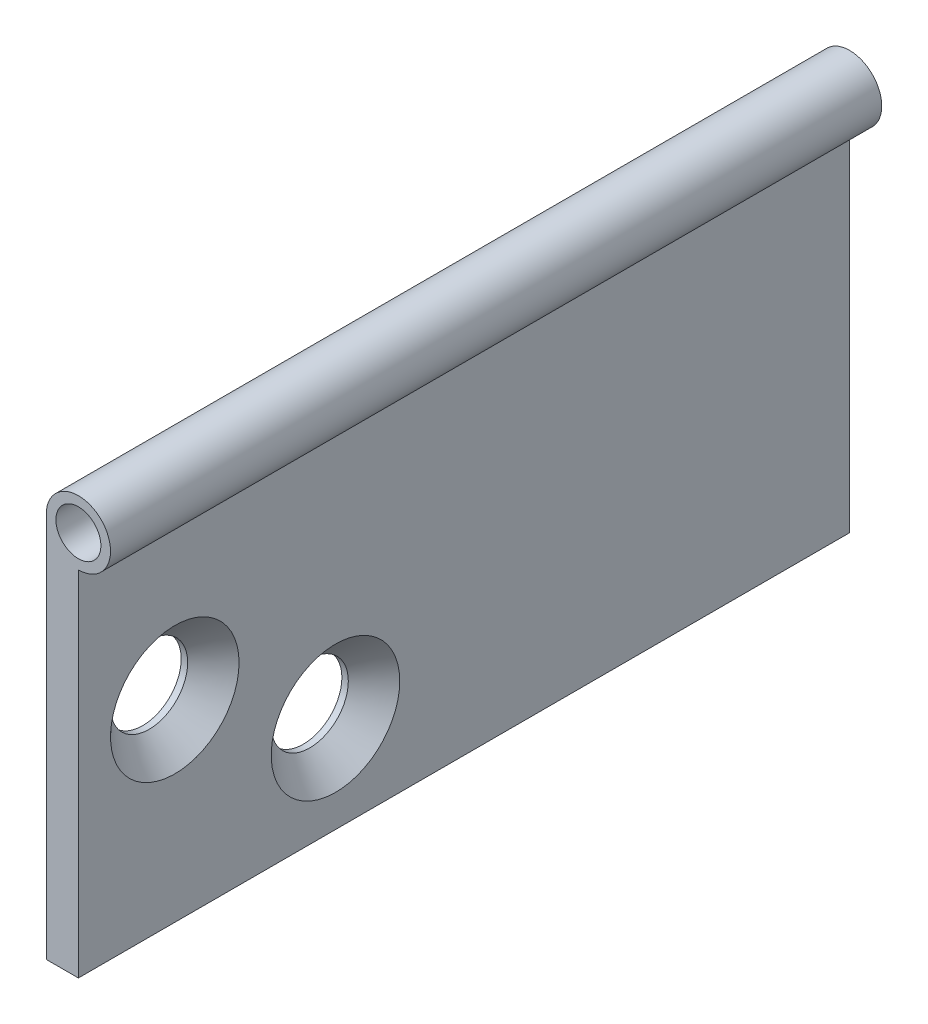
from build123d import *

# Parameters (mm, degrees)
SKETCH_1_W                  = 5
SKETCH_1_H                  = 60
EXTRUDE_2_DEPTH             = 60
SKETCH_2_R                  = 5
SKETCH_3_R                  = 3.5
CUT_EXTRUDE_1_DEPTH         = 137.839321834
HOLE_WIZARD_M101_AT_2_COUNT = 2
HOLE_WIZARD_M101_AT_2_PITCH = 29.154759474


with BuildPart() as part:
    # Эскиз1 → Вытянуть-Тонкостенный2 (new, symmetric)
    with BuildSketch(Plane.XY):
        with Locations((2.5, 30)):
            Rectangle(SKETCH_1_W, SKETCH_1_H)
    extrude(amount=EXTRUDE_2_DEPTH, both=True)

    # По траектории1: sweep along a curve in space
    with BuildLine() as sweep_1_path:
        Line((0, 60, 60), (0, 60, -60))
    # Эскиз2 → По траектории1 (sweep)
    with BuildSketch(Plane.XY.offset(60)):
        with Locations((5, 60)):
            Circle(SKETCH_2_R)
    sweep(path=sweep_1_path.line)

    # Эскиз3 → Вырез-Вытянуть1 (cut, through all)
    with BuildSketch(Plane.XY.offset(60)):
        with Locations((5, 60)):
            Circle(SKETCH_3_R)
    extrude(amount=-CUT_EXTRUDE_1_DEPTH, mode=Mode.SUBTRACT)

    # Эскиз8 → Зенковка для  винта с плоской головкой M101 (revolve, cut)
    with BuildSketch(Plane(origin=(5, 30, 45), x_dir=(0, 0, -1), z_dir=(0, 1, 0))):
        Polygon((0, 0), (0, 5), (6, 5), (6, 4), (10, 0), align=None)
    hole_wizard_m101 = revolve(axis=Axis((11.35, 30, 45), (-1, 0, 0)), mode=Mode.SUBTRACT)

    # Зенковка для  винта с плоской головкой M101 at 2: Зенковка для  винта с плоской головкой M101 ×2
    with Locations(*[Vector(0, -0.5144957554275265, -0.8574929257125442) * (i * HOLE_WIZARD_M101_AT_2_PITCH) for i in range(1, HOLE_WIZARD_M101_AT_2_COUNT)]):
        add(hole_wizard_m101, mode=Mode.SUBTRACT)


solid = part.part
